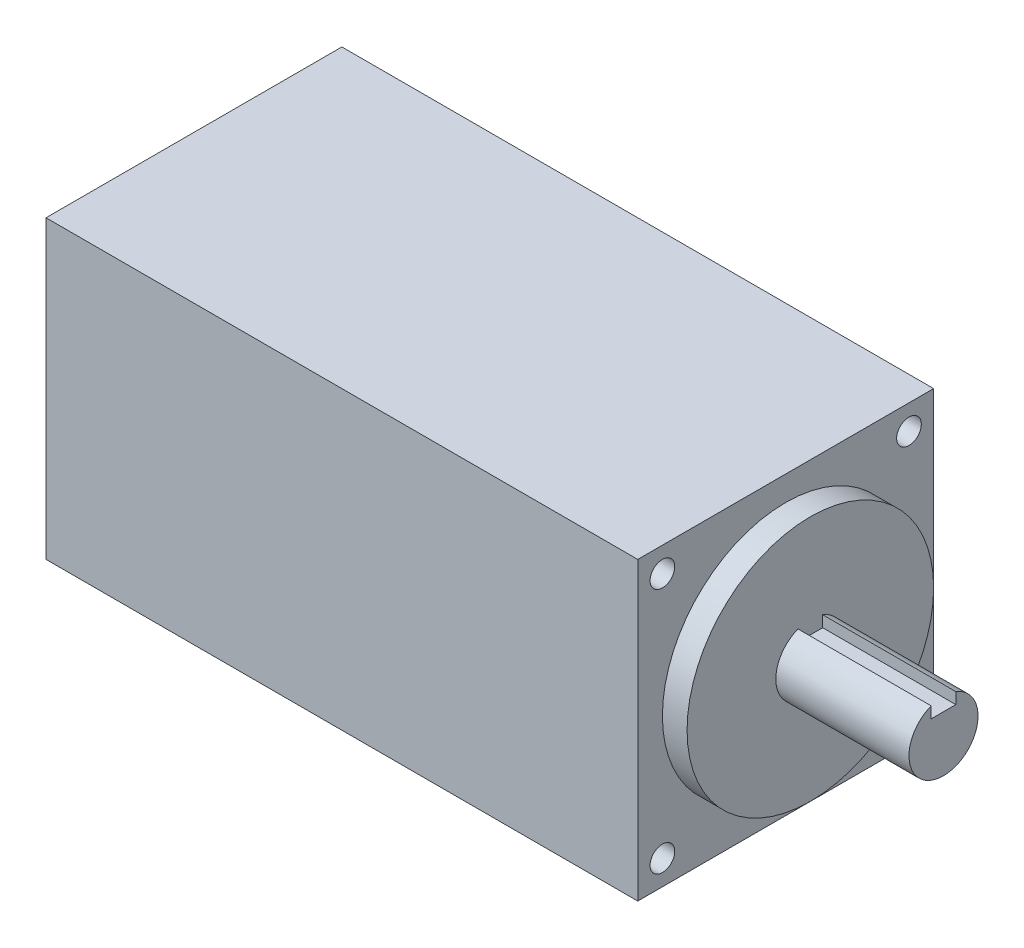
from build123d import *

# Parameters (mm, degrees)
SKETCH_1_W          = 60
SKETCH_1_H          = 60
EXTRUDE_1_DEPTH     = 120
SKETCH_2_R          = 2.5
CUT_EXTRUDE_1_DEPTH = 20
SKETCH_3_R          = 25
EXTRUDE_2_DEPTH     = 5
SKETCH_4_R          = 7
EXTRUDE_3_DEPTH     = 27
SKETCH_5_W          = 5
SKETCH_5_H          = 2.748835856
CUT_EXTRUDE_2_DEPTH = 27


with BuildPart() as part:
    # 草图1 → 凸台-拉伸1 (new body)
    with BuildSketch(Plane(origin=(0, 0, 0), x_dir=(0, 0, -1), z_dir=(1, 0, 0))):
        Rectangle(SKETCH_1_W, SKETCH_1_H)
    extrude(amount=-EXTRUDE_1_DEPTH)

    # 草图2 → 切除-拉伸1 (cut)
    with BuildSketch(Plane(origin=(0, 0, 0), x_dir=(0, 0, -1), z_dir=(1, 0, 0))):
        with Locations((-25, 25)):
            Circle(SKETCH_2_R)
        with Locations((25, 25)):
            Circle(SKETCH_2_R)
        with Locations((-25, -25)):
            Circle(SKETCH_2_R)
        with Locations((25, -25)):
            Circle(SKETCH_2_R)
    extrude(amount=-CUT_EXTRUDE_1_DEPTH, mode=Mode.SUBTRACT)

    # 草图3 → 凸台-拉伸2 (add)
    with BuildSketch(Plane(origin=(0, 0, 0), x_dir=(0, 0, -1), z_dir=(1, 0, 0))):
        Circle(SKETCH_3_R)
    extrude(amount=EXTRUDE_2_DEPTH)

    # 草图4 → 凸台-拉伸3 (add)
    with BuildSketch(Plane(origin=(5, 0, 0), x_dir=(0, 0, -1), z_dir=(1, 0, 0))):
        Circle(SKETCH_4_R)
    extrude(amount=EXTRUDE_3_DEPTH)

    # 草图5 → 切除-拉伸2 (cut)
    with BuildSketch(Plane(origin=(32, 0, 0), x_dir=(0, 0, -1), z_dir=(1, 0, 0))):
        with Locations((0, 5.625582072)):
            Rectangle(SKETCH_5_W, SKETCH_5_H)
    extrude(amount=-CUT_EXTRUDE_2_DEPTH, mode=Mode.SUBTRACT)


solid = part.part
